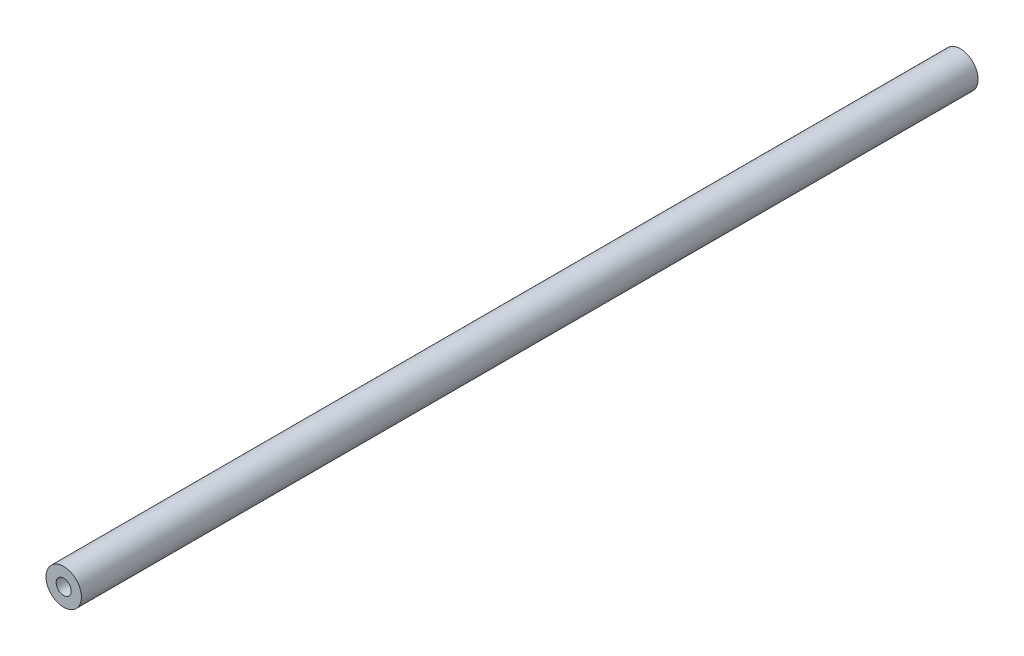
from build123d import *

# Parameters (mm, degrees)
SKETCH1_R                            = 4.7625
BOSS_EXTRUDE1_DEPTH                  = 120.65
F_10_32_TAPPED_HOLE1_D               = 4.0386
F_10_32_TAPPED_HOLE1_DEPTH           = 11.938
F_10_32_TAPPED_HOLE1_TIP             = 1.213317848
F_10_32_TAPPED_HOLE1_ON_FACE_2_D     = 4.0386
F_10_32_TAPPED_HOLE1_ON_FACE_2_DEPTH = 11.938
F_10_32_TAPPED_HOLE1_ON_FACE_2_TIP   = 1.213317848


with BuildPart() as part:
    # Sketch1 → Boss-Extrude1 (new, symmetric)
    with BuildSketch(Plane.XY):
        with Locations(Location((0, 0, 0), (0, 0, 180))):
            Circle(SKETCH1_R)
    extrude(amount=BOSS_EXTRUDE1_DEPTH, both=True)

    # #10-32 Tapped Hole1
    with Locations(Plane.XY.offset(120.65)):
        with Locations((0, 0)):
            Hole(F_10_32_TAPPED_HOLE1_D / 2, depth=F_10_32_TAPPED_HOLE1_DEPTH)
            with Locations((0, 0, -(F_10_32_TAPPED_HOLE1_DEPTH + F_10_32_TAPPED_HOLE1_TIP / 2))):  # 118° drill point
                Cone(0, F_10_32_TAPPED_HOLE1_D / 2, F_10_32_TAPPED_HOLE1_TIP, mode=Mode.SUBTRACT)

    # #10-32 Tapped Hole1 on face 2
    with Locations(Plane(origin=(0, 0, -120.65), x_dir=(-1, 0, 0), z_dir=(0, 0, -1))):
        with Locations((0, 0)):
            Hole(F_10_32_TAPPED_HOLE1_ON_FACE_2_D / 2, depth=F_10_32_TAPPED_HOLE1_ON_FACE_2_DEPTH)
            with Locations((0, 0, -(F_10_32_TAPPED_HOLE1_ON_FACE_2_DEPTH + F_10_32_TAPPED_HOLE1_ON_FACE_2_TIP / 2))):  # 118° drill point
                Cone(0, F_10_32_TAPPED_HOLE1_ON_FACE_2_D / 2, F_10_32_TAPPED_HOLE1_ON_FACE_2_TIP, mode=Mode.SUBTRACT)


solid = part.part
